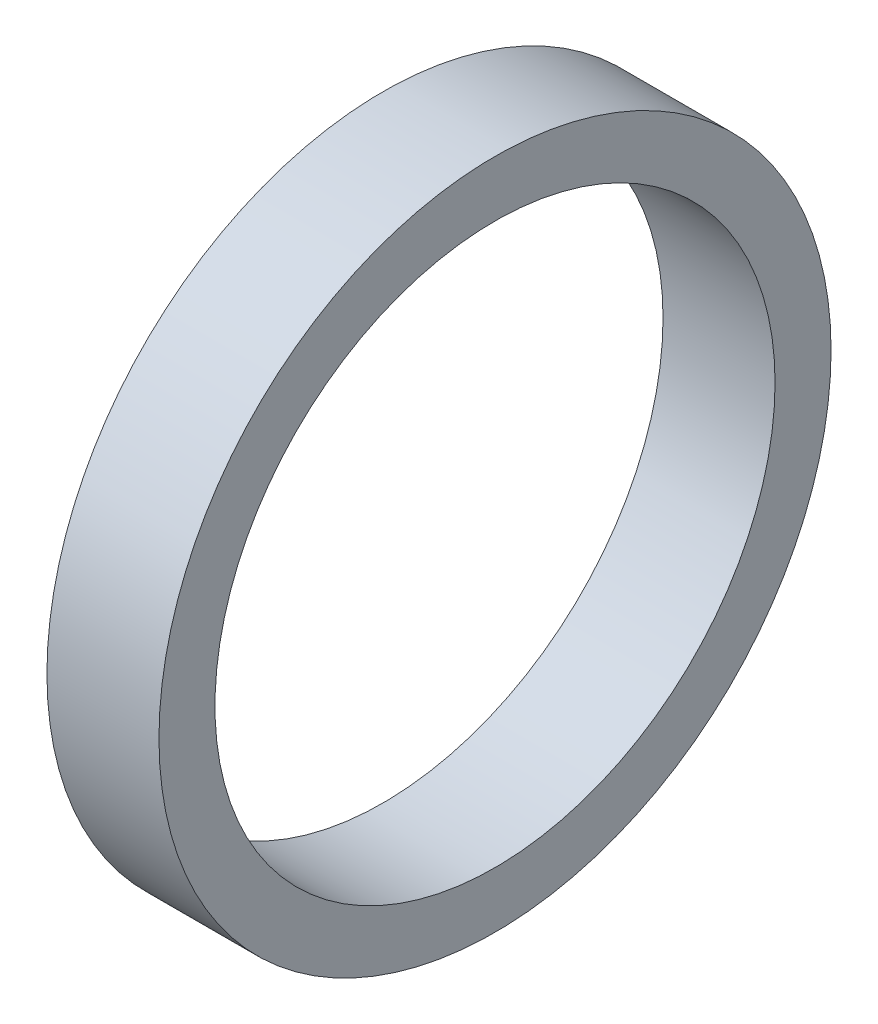
from build123d import *

# Parameters (mm, degrees)
SKETCH_1_R      = 9
SKETCH_1_R_2    = 7.5
EXTRUDE_1_DEPTH = 3


with BuildPart() as part:
    # Эскиз1 → Бобышка-Вытянуть1 (new body)
    with BuildSketch(Plane(origin=(0, 0, 0), x_dir=(0, 0, -1), z_dir=(1, 0, 0))):
        Circle(SKETCH_1_R)
        Circle(SKETCH_1_R_2, mode=Mode.SUBTRACT)
    extrude(amount=EXTRUDE_1_DEPTH)


solid = part.part
